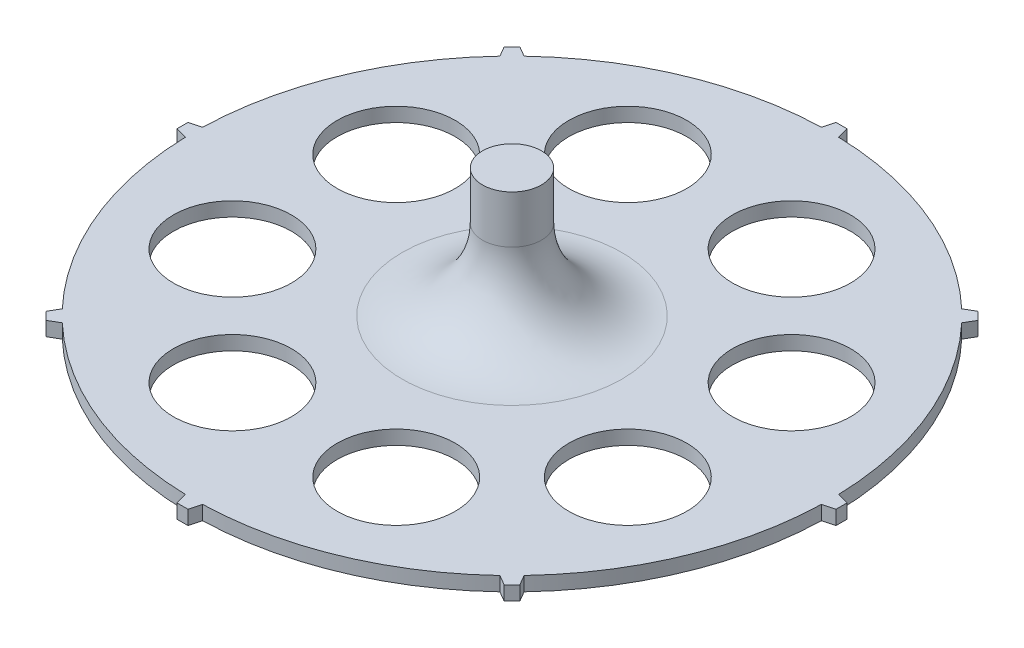
from build123d import *

# Parameters (mm, degrees)
SKETCH1_R            = 85.725
BOSS_EXTRUDE1_DEPTH  = 62.865
FILLET1_R            = 3.175
FILLET1_OF_MIRROR1_R = 3.175
FILLET2_R            = 21.59
CUT_EXTRUDE2_START   = 34.45
SKETCH5_R            = 92.075
SKETCH5_R_2          = 85.725
CUT_EXTRUDE2_DEPTH   = 219.00798967
SKETCH6_W            = 171.45
SKETCH6_H            = 25.581957496
CUT_EXTRUDE3_DEPTH   = 88.9
BOSS_EXTRUDE2_START  = -94.93
BOSS_EXTRUDE2_DEPTH  = 3.81
CUT_EXTRUDE5_DEPTH   = 130.946195435
SKETCH9_R            = 15.875
CUT_EXTRUDE6_DEPTH   = 130.946195435


with BuildPart() as part:
    # Sketch1 → Boss-Extrude1 (new, symmetric)
    with BuildSketch(Plane(origin=(0, 0, 0), x_dir=(1, 0, 0), z_dir=(0, 1, 0))):
        with BuildLine():
            Line((13.371386035, 89.497618576), (13.619190523, 91.06219454))
            ThreePointArc((13.619190523, 91.06219454), (7.224121239, 91.791163503), (0.79375, 92.0715786))
            Line((0.79375, 92.0715786), (0.79375, 90.4875))
            Line((0.79375, 90.4875), (-0.79375, 90.4875))
            Line((-0.79375, 90.4875), (-0.79375, 92.0715786))
            ThreePointArc((-0.79375, 92.0715786), (-7.224121239, 91.791163503), (-13.619190523, 91.06219454))
            Line((-13.619190523, 91.06219454), (-13.371386035, 89.497618576))
            Line((-13.371386035, 89.497618576), (-14.939341276, 89.249278863))
            Line((-14.939341276, 89.249278863), (-15.187145764, 90.813854827))
            ThreePointArc((-15.187145764, 90.813854827), (-21.494481877, 89.530960421), (-27.696781377, 87.810557033))
            Line((-27.696781377, 87.810557033), (-27.207274169, 86.304008758))
            Line((-27.207274169, 86.304008758), (-28.717076388, 85.813444279))
            Line((-28.717076388, 85.813444279), (-29.206583596, 87.319992554))
            ThreePointArc((-29.206583596, 87.319992554), (-35.235577035, 85.066207956), (-41.092385552, 82.396732184))
            Line((-41.092385552, 82.396732184), (-40.373228917, 80.985307817))
            Line((-40.373228917, 80.985307817), (-41.787701774, 80.264597898))
            Line((-41.787701774, 80.264597898), (-42.506858409, 81.676022266))
            ThreePointArc((-42.506858409, 81.676022266), (-48.109055346, 78.506843133), (-53.476158817, 74.954026331))
            Line((-53.476158817, 74.954026331), (-52.545060778, 73.672479823))
            Line((-52.545060778, 73.672479823), (-53.829375256, 72.739370734))
            Line((-53.829375256, 72.739370734), (-54.760473296, 74.020917243))
            ThreePointArc((-54.760473296, 74.020917243), (-59.79792905, 70.014379283), (-64.543171575, 65.66570359))
            Line((-64.543171575, 65.66570359), (-63.423058855, 64.54559087))
            Line((-63.423058855, 64.54559087), (-64.54559087, 63.423058855))
            Line((-64.54559087, 63.423058855), (-65.66570359, 64.543171575))
            ThreePointArc((-65.66570359, 64.543171575), (-70.014379283, 59.79792905), (-74.020917243, 54.760473296))
            Line((-74.020917243, 54.760473296), (-72.739370734, 53.829375256))
            Line((-72.739370734, 53.829375256), (-73.672479823, 52.545060778))
            Line((-73.672479823, 52.545060778), (-74.954026331, 53.476158817))
            ThreePointArc((-74.954026331, 53.476158817), (-78.506843133, 48.109055346), (-81.676022266, 42.506858409))
            Line((-81.676022266, 42.506858409), (-80.264597898, 41.787701774))
            Line((-80.264597898, 41.787701774), (-80.985307817, 40.373228917))
            Line((-80.985307817, 40.373228917), (-82.396732184, 41.092385552))
            ThreePointArc((-82.396732184, 41.092385552), (-85.066207956, 35.235577035), (-87.319992554, 29.206583596))
            Line((-87.319992554, 29.206583596), (-85.813444279, 28.717076388))
            Line((-85.813444279, 28.717076388), (-86.304008758, 27.207274169))
            Line((-86.304008758, 27.207274169), (-87.810557033, 27.696781377))
            ThreePointArc((-87.810557033, 27.696781377), (-89.530960421, 21.494481877), (-90.813854827, 15.187145764))
            Line((-90.813854827, 15.187145764), (-89.249278863, 14.939341276))
            Line((-89.249278863, 14.939341276), (-89.497618576, 13.371386035))
            Line((-89.497618576, 13.371386035), (-91.06219454, 13.619190523))
            ThreePointArc((-91.06219454, 13.619190523), (-91.791163503, 7.224121239), (-92.0715786, 0.79375))
            Line((-92.0715786, 0.79375), (-90.4875, 0.79375))
            Line((-90.4875, 0.79375), (-90.4875, -0.79375))
            Line((-90.4875, -0.79375), (-92.0715786, -0.79375))
            ThreePointArc((-92.0715786, -0.79375), (-91.791163503, -7.224121239), (-91.06219454, -13.619190523))
            Line((-91.06219454, -13.619190523), (-89.497618576, -13.371386035))
            Line((-89.497618576, -13.371386035), (-89.249278863, -14.939341276))
            Line((-89.249278863, -14.939341276), (-90.813854827, -15.187145764))
            ThreePointArc((-90.813854827, -15.187145764), (-89.530960421, -21.494481877), (-87.810557033, -27.696781377))
            Line((-87.810557033, -27.696781377), (-86.304008758, -27.207274169))
            Line((-86.304008758, -27.207274169), (-85.813444279, -28.717076388))
            Line((-85.813444279, -28.717076388), (-87.319992554, -29.206583596))
            ThreePointArc((-87.319992554, -29.206583596), (-85.066207956, -35.235577035), (-82.396732184, -41.092385552))
            Line((-82.396732184, -41.092385552), (-80.985307817, -40.373228917))
            Line((-80.985307817, -40.373228917), (-80.264597898, -41.787701774))
            Line((-80.264597898, -41.787701774), (-81.676022266, -42.506858409))
            ThreePointArc((-81.676022266, -42.506858409), (-78.506843133, -48.109055346), (-74.954026331, -53.476158817))
            Line((-74.954026331, -53.476158817), (-73.672479822, -52.545060778))
            Line((-73.672479822, -52.545060778), (-72.739370734, -53.829375256))
            Line((-72.739370734, -53.829375256), (-74.020917242, -54.760473296))
            ThreePointArc((-74.020917242, -54.760473296), (-70.014379283, -59.79792905), (-65.66570359, -64.543171575))
            Line((-65.66570359, -64.543171575), (-64.54559087, -63.423058855))
            Line((-64.54559087, -63.423058855), (-63.423058855, -64.54559087))
            Line((-63.423058855, -64.54559087), (-64.543171575, -65.66570359))
            ThreePointArc((-64.543171575, -65.66570359), (-59.79792905, -70.014379283), (-54.760473296, -74.020917243))
            Line((-54.760473296, -74.020917243), (-53.829375256, -72.739370735))
            Line((-53.829375256, -72.739370735), (-52.545060778, -73.672479823))
            Line((-52.545060778, -73.672479823), (-53.476158817, -74.954026331))
            ThreePointArc((-53.476158817, -74.954026331), (-48.109055346, -78.506843133), (-42.506858409, -81.676022266))
            Line((-42.506858409, -81.676022266), (-41.787701774, -80.264597898))
            Line((-41.787701774, -80.264597898), (-40.373228917, -80.985307817))
            Line((-40.373228917, -80.985307817), (-41.092385552, -82.396732184))
            ThreePointArc((-41.092385552, -82.396732184), (-35.235577035, -85.066207956), (-29.206583596, -87.319992554))
            Line((-29.206583596, -87.319992554), (-28.717076388, -85.813444279))
            Line((-28.717076388, -85.813444279), (-27.207274169, -86.304008758))
            Line((-27.207274169, -86.304008758), (-27.696781377, -87.810557033))
            ThreePointArc((-27.696781377, -87.810557033), (-21.494481877, -89.530960421), (-15.187145764, -90.813854827))
            Line((-15.187145764, -90.813854827), (-14.939341276, -89.249278863))
            Line((-14.939341276, -89.249278863), (-13.371386035, -89.497618576))
            Line((-13.371386035, -89.497618576), (-13.619190523, -91.06219454))
            ThreePointArc((-13.619190523, -91.06219454), (-7.224121239, -91.791163503), (-0.79375, -92.0715786))
            Line((-0.79375, -92.0715786), (-0.79375, -90.4875))
            Line((-0.79375, -90.4875), (0.79375, -90.4875))
            Line((0.79375, -90.4875), (0.79375, -92.0715786))
            ThreePointArc((0.79375, -92.0715786), (7.224121239, -91.791163503), (13.619190523, -91.06219454))
            Line((13.619190523, -91.06219454), (13.371386035, -89.497618576))
            Line((13.371386035, -89.497618576), (14.939341276, -89.249278863))
            Line((14.939341276, -89.249278863), (15.187145764, -90.813854827))
            ThreePointArc((15.187145764, -90.813854827), (21.494481877, -89.530960421), (27.696781377, -87.810557033))
            Line((27.696781377, -87.810557033), (27.207274169, -86.304008758))
            Line((27.207274169, -86.304008758), (28.717076388, -85.813444279))
            Line((28.717076388, -85.813444279), (29.206583596, -87.319992554))
            ThreePointArc((29.206583596, -87.319992554), (35.235577035, -85.066207956), (41.092385552, -82.396732184))
            Line((41.092385552, -82.396732184), (40.373228917, -80.985307817))
            Line((40.373228917, -80.985307817), (41.787701774, -80.264597898))
            Line((41.787701774, -80.264597898), (42.506858409, -81.676022266))
            ThreePointArc((42.506858409, -81.676022266), (48.109055346, -78.506843133), (53.476158817, -74.954026331))
            Line((53.476158817, -74.954026331), (52.545060778, -73.672479823))
            Line((52.545060778, -73.672479823), (53.829375256, -72.739370734))
            Line((53.829375256, -72.739370734), (54.760473296, -74.020917242))
            ThreePointArc((54.760473296, -74.020917242), (59.79792905, -70.014379283), (64.543171575, -65.66570359))
            Line((64.543171575, -65.66570359), (63.423058855, -64.54559087))
            Line((63.423058855, -64.54559087), (64.54559087, -63.423058855))
            Line((64.54559087, -63.423058855), (65.66570359, -64.543171575))
            ThreePointArc((65.66570359, -64.543171575), (70.014379283, -59.79792905), (74.020917243, -54.760473296))
            Line((74.020917243, -54.760473296), (72.739370735, -53.829375256))
            Line((72.739370735, -53.829375256), (73.672479823, -52.545060778))
            Line((73.672479823, -52.545060778), (74.954026331, -53.476158817))
            ThreePointArc((74.954026331, -53.476158817), (78.506843133, -48.109055346), (81.676022266, -42.506858409))
            Line((81.676022266, -42.506858409), (80.264597898, -41.787701774))
            Line((80.264597898, -41.787701774), (80.985307817, -40.373228917))
            Line((80.985307817, -40.373228917), (82.396732184, -41.092385552))
            ThreePointArc((82.396732184, -41.092385552), (85.066207956, -35.235577035), (87.319992554, -29.206583596))
            Line((87.319992554, -29.206583596), (85.813444279, -28.717076388))
            Line((85.813444279, -28.717076388), (86.304008758, -27.207274169))
            Line((86.304008758, -27.207274169), (87.810557033, -27.696781377))
            ThreePointArc((87.810557033, -27.696781377), (89.530960421, -21.494481877), (90.813854827, -15.187145764))
            Line((90.813854827, -15.187145764), (89.249278863, -14.939341276))
            Line((89.249278863, -14.939341276), (89.497618576, -13.371386035))
            Line((89.497618576, -13.371386035), (91.06219454, -13.619190523))
            ThreePointArc((91.06219454, -13.619190523), (91.791163503, -7.224121239), (92.0715786, -0.79375))
            Line((92.0715786, -0.79375), (90.4875, -0.79375))
            Line((90.4875, -0.79375), (90.4875, 0.79375))
            Line((90.4875, 0.79375), (92.0715786, 0.79375))
            ThreePointArc((92.0715786, 0.79375), (91.791163503, 7.224121239), (91.06219454, 13.619190523))
            Line((91.06219454, 13.619190523), (89.497618576, 13.371386035))
            Line((89.497618576, 13.371386035), (89.249278863, 14.939341276))
            Line((89.249278863, 14.939341276), (90.813854827, 15.187145764))
            ThreePointArc((90.813854827, 15.187145764), (89.530960421, 21.494481877), (87.810557033, 27.696781377))
            Line((87.810557033, 27.696781377), (86.304008758, 27.207274169))
            Line((86.304008758, 27.207274169), (85.813444279, 28.717076388))
            Line((85.813444279, 28.717076388), (87.319992554, 29.206583596))
            ThreePointArc((87.319992554, 29.206583596), (85.066207956, 35.235577035), (82.396732184, 41.092385552))
            Line((82.396732184, 41.092385552), (80.985307817, 40.373228917))
            Line((80.985307817, 40.373228917), (80.264597898, 41.787701774))
            Line((80.264597898, 41.787701774), (81.676022266, 42.506858409))
            ThreePointArc((81.676022266, 42.506858409), (78.506843133, 48.109055346), (74.954026331, 53.476158817))
            Line((74.954026331, 53.476158817), (73.672479823, 52.545060778))
            Line((73.672479823, 52.545060778), (72.739370735, 53.829375256))
            Line((72.739370735, 53.829375256), (74.020917243, 54.760473296))
            ThreePointArc((74.020917243, 54.760473296), (70.014379283, 59.79792905), (65.66570359, 64.543171575))
            Line((65.66570359, 64.543171575), (64.54559087, 63.423058855))
            Line((64.54559087, 63.423058855), (63.423058855, 64.54559087))
            Line((63.423058855, 64.54559087), (64.543171575, 65.66570359))
            ThreePointArc((64.543171575, 65.66570359), (59.79792905, 70.014379283), (54.760473296, 74.020917243))
            Line((54.760473296, 74.020917243), (53.829375256, 72.739370735))
            Line((53.829375256, 72.739370735), (52.545060778, 73.672479823))
            Line((52.545060778, 73.672479823), (53.476158817, 74.954026331))
            ThreePointArc((53.476158817, 74.954026331), (48.109055346, 78.506843133), (42.506858409, 81.676022266))
            Line((42.506858409, 81.676022266), (41.787701774, 80.264597898))
            Line((41.787701774, 80.264597898), (40.373228917, 80.985307817))
            Line((40.373228917, 80.985307817), (41.092385552, 82.396732184))
            ThreePointArc((41.092385552, 82.396732184), (35.235577035, 85.066207956), (29.206583596, 87.319992554))
            Line((29.206583596, 87.319992554), (28.717076388, 85.813444279))
            Line((28.717076388, 85.813444279), (27.207274169, 86.304008758))
            Line((27.207274169, 86.304008758), (27.696781377, 87.810557033))
            ThreePointArc((27.696781377, 87.810557033), (21.494481877, 89.530960421), (15.187145764, 90.813854827))
            Line((15.187145764, 90.813854827), (14.939341276, 89.249278863))
            Line((14.939341276, 89.249278863), (13.371386035, 89.497618576))
        make_face()
        with Locations(Location((0, 0, 0), (0, 0, 270))):
            Circle(SKETCH1_R, mode=Mode.SUBTRACT)
    extrude(amount=BOSS_EXTRUDE1_DEPTH, both=True)

    # Sketch2 → Revolve1 (revolve)
    with BuildSketch(Plane.XY):
        Polygon((0, 81.915), (0, 41.115), (-85.725, 41.115), (-85.725, 47.465), (-7.9375, 47.465), (-7.9375, 81.915), align=None)
    revolve1 = revolve(axis=Axis((0, 81.915, 0), (0, -1, 0)))

    # Fillet1
    fillet1_edges = [part.edges().sort_by_distance(p)[0] for p in [
        (0, 41.115, -85.725),
    ]]
    fillet(fillet1_edges, radius=FILLET1_R)

    # Mirror1: Revolve1 across plane
    add(revolve1.mirror(Plane.ZX))

    # Fillet1 of Mirror1
    fillet1_of_mirror1_edges = [part.edges().sort_by_distance(p)[0] for p in [
        (0, -41.115, -85.725),
    ]]
    fillet(fillet1_of_mirror1_edges, radius=FILLET1_OF_MIRROR1_R)

    # Fillet2
    fillet2_edges = [part.edges().sort_by_distance(p)[0] for p in [
        (7.9375, 47.465, 0),
        (7.9375, -47.465, 0),
    ]]
    fillet(fillet2_edges, radius=FILLET2_R)

    # Sketch5 → Cut-Extrude2 (cut, through all)
    with BuildSketch(Plane.XZ.offset(47.465).offset(CUT_EXTRUDE2_START)):
        Circle(SKETCH5_R)
        Circle(SKETCH5_R_2, mode=Mode.SUBTRACT)
    extrude(amount=-CUT_EXTRUDE2_DEPTH, mode=Mode.SUBTRACT)


with BuildPart() as cut_extrude2_kept_piece:
    # of the separate pieces the step leaves, the one the design keeps (cut_extrude2_pieces_kept)
    add(part.part.solids().sort_by_distance((-29.5275, 47.465, 0))[0])

    # Sketch6 → Cut-Extrude3 (cut, symmetric)
    with BuildSketch(Plane.XY):
        with Locations((0, 30.864021252)):
            Rectangle(SKETCH6_W, SKETCH6_H)
    extrude(amount=CUT_EXTRUDE3_DEPTH, both=True, mode=Mode.SUBTRACT)

    # Sketch5<5> → Boss-Extrude2 (add)
    with BuildSketch(Plane.XZ.offset(47.465).offset(BOSS_EXTRUDE2_START)):
        with BuildLine():
            Line((1.489458784, -88.598), (2.249038414, -85.695492596))
            ThreePointArc((2.249038414, -85.695492596), (0, -85.725), (-2.249038414, -85.695492596))
            Line((-2.249038414, -85.695492596), (-1.489458784, -88.598))
            Line((-1.489458784, -88.598), (1.489458784, -88.598))
        make_face()
        with BuildLine():
            Line((-61.595040193, -63.701453006), (-59.005553618, -62.186174245))
            ThreePointArc((-59.005553618, -62.186174245), (-60.616728817, -60.616728817), (-62.186174245, -59.005553618))
            Line((-62.186174245, -59.005553618), (-63.701453006, -61.595040193))
            Line((-63.701453006, -61.595040193), (-61.595040193, -63.701453006))
        make_face()
        with BuildLine():
            ThreePointArc((-85.695492596, -2.249038414), (-85.725, 0), (-85.695492596, 2.249038414))
            Line((-85.695492596, 2.249038414), (-88.598, 1.489458784))
            Line((-88.598, 1.489458784), (-88.598, -1.489458784))
            Line((-88.598, -1.489458784), (-85.695492596, -2.249038414))
        make_face()
        with BuildLine():
            ThreePointArc((-62.186174245, 59.005553618), (-60.616728817, 60.616728817), (-59.005553618, 62.186174245))
            Line((-59.005553618, 62.186174245), (-61.595040193, 63.701453006))
            Line((-61.595040193, 63.701453006), (-63.701453006, 61.595040193))
            Line((-63.701453006, 61.595040193), (-62.186174245, 59.005553618))
        make_face()
        with BuildLine():
            ThreePointArc((-2.249038414, 85.695492596), (0, 85.725), (2.249038414, 85.695492596))
            Line((2.249038414, 85.695492596), (1.489458784, 88.598))
            Line((1.489458784, 88.598), (-1.489458784, 88.598))
            Line((-1.489458784, 88.598), (-2.249038414, 85.695492596))
        make_face()
        with BuildLine():
            ThreePointArc((59.005553618, 62.186174245), (60.616728817, 60.616728817), (62.186174245, 59.005553618))
            Line((62.186174245, 59.005553618), (63.701453006, 61.595040193))
            Line((63.701453006, 61.595040193), (61.595040193, 63.701453006))
            Line((61.595040193, 63.701453006), (59.005553618, 62.186174245))
        make_face()
        with BuildLine():
            Line((88.598, 1.489458784), (85.695492596, 2.249038414))
            ThreePointArc((85.695492596, 2.249038414), (85.717622831, 1.124615987), (85.725, 0))
            ThreePointArc((85.725, 0), (85.717622831, -1.124615987), (85.695492596, -2.249038414))
            Line((85.695492596, -2.249038414), (88.598, -1.489458784))
            Line((88.598, -1.489458784), (88.598, 1.489458784))
        make_face()
        with BuildLine():
            Line((63.701453006, -61.595040193), (62.186174245, -59.005553618))
            ThreePointArc((62.186174245, -59.005553618), (60.616728817, -60.616728817), (59.005553618, -62.186174245))
            Line((59.005553618, -62.186174245), (61.595040193, -63.701453006))
            Line((61.595040193, -63.701453006), (63.701453006, -61.595040193))
        make_face()
    extrude(amount=BOSS_EXTRUDE2_DEPTH)

    # Sketch8 → Cut-Extrude5 (cut, through all)
    with BuildSketch(Plane(origin=(0, 47.465, 0), x_dir=(1, 0, 0), z_dir=(0, 1, 0))):
        with BuildLine():
            Line((-85.503591154, -2.299258587), (-85.695492596, -2.249038414))
            ThreePointArc((-85.695492596, -2.249038414), (-79.199572925, -32.805537239), (-62.186174245, -59.005553618))
            Line((-62.186174245, -59.005553618), (-62.08599046, -58.834347782))
            ThreePointArc((-62.08599046, -58.834347782), (-79.023573874, -32.732636046), (-85.503591154, -2.299258587))
        make_face()
        with BuildLine():
            ThreePointArc((-2.299258587, -85.503591154), (-32.732636046, -79.023573874), (-58.834347782, -62.08599046))
            Line((-58.834347782, -62.08599046), (-59.005553618, -62.186174245))
            ThreePointArc((-59.005553618, -62.186174245), (-32.805537239, -79.199572925), (-2.249038414, -85.695492596))
            Line((-2.249038414, -85.695492596), (-2.299258587, -85.503591154))
        make_face()
        with BuildLine():
            ThreePointArc((58.834347782, -62.08599046), (32.732636046, -79.023573874), (2.299258587, -85.503591154))
            Line((2.299258587, -85.503591154), (2.249038414, -85.695492596))
            ThreePointArc((2.249038414, -85.695492596), (32.805537239, -79.199572925), (59.005553618, -62.186174245))
            Line((59.005553618, -62.186174245), (58.834347782, -62.08599046))
        make_face()
        with BuildLine():
            ThreePointArc((85.503591154, -2.299258587), (79.023573874, -32.732636046), (62.08599046, -58.834347782))
            Line((62.08599046, -58.834347782), (62.186174245, -59.005553618))
            ThreePointArc((62.186174245, -59.005553618), (79.199572925, -32.805537239), (85.695492596, -2.249038414))
            Line((85.695492596, -2.249038414), (85.503591154, -2.299258587))
        make_face()
        with BuildLine():
            Line((62.186174245, 59.005553618), (62.08599046, 58.834347782))
            ThreePointArc((62.08599046, 58.834347782), (79.023573874, 32.732636046), (85.503591154, 2.299258587))
            Line((85.503591154, 2.299258587), (85.695492596, 2.249038414))
            ThreePointArc((85.695492596, 2.249038414), (79.199572925, 32.805537239), (62.186174245, 59.005553618))
        make_face()
        with BuildLine():
            Line((2.249038414, 85.695492596), (2.299258587, 85.503591154))
            ThreePointArc((2.299258587, 85.503591154), (32.732636046, 79.023573874), (58.834347782, 62.08599046))
            Line((58.834347782, 62.08599046), (59.005553618, 62.186174245))
            ThreePointArc((59.005553618, 62.186174245), (32.805537239, 79.199572925), (2.249038414, 85.695492596))
        make_face()
        with BuildLine():
            Line((-59.005553618, 62.186174245), (-58.834347782, 62.08599046))
            ThreePointArc((-58.834347782, 62.08599046), (-32.732636046, 79.023573874), (-2.299258587, 85.503591154))
            Line((-2.299258587, 85.503591154), (-2.249038414, 85.695492596))
            ThreePointArc((-2.249038414, 85.695492596), (-32.805537239, 79.199572925), (-59.005553618, 62.186174245))
        make_face()
        with BuildLine():
            Line((-85.695492596, 2.249038414), (-85.503591154, 2.299258587))
            ThreePointArc((-85.503591154, 2.299258587), (-79.023573874, 32.732636046), (-62.08599046, 58.834347782))
            Line((-62.08599046, 58.834347782), (-62.186174245, 59.005553618))
            ThreePointArc((-62.186174245, 59.005553618), (-79.199572925, 32.805537239), (-85.695492596, 2.249038414))
        make_face()
    extrude(amount=-CUT_EXTRUDE5_DEPTH, mode=Mode.SUBTRACT)

    # Sketch9 → Cut-Extrude6 (cut, through all)
    with BuildSketch(Plane(origin=(0, 47.465, 0), x_dir=(1, 0, 0), z_dir=(0, 1, 0))):
        with Locations(Location((-22.016160547, 53.151713385, 0), (0, 0, 180))):
            Circle(SKETCH9_R)
        with Locations(Location((22.016160547, 53.151713385, 0), (0, 0, 180))):
            Circle(SKETCH9_R)
        with Locations(Location((53.151713385, 22.016160547, 0), (0, 0, 180))):
            Circle(SKETCH9_R)
        with Locations(Location((53.151713385, -22.016160547, 0), (0, 0, 180))):
            Circle(SKETCH9_R)
        with Locations(Location((22.016160547, -53.151713385, 0), (0, 0, 180))):
            Circle(SKETCH9_R)
        with Locations(Location((-22.016160547, -53.151713385, 0), (0, 0, 180))):
            Circle(SKETCH9_R)
        with Locations(Location((-53.151713385, -22.016160547, 0), (0, 0, 180))):
            Circle(SKETCH9_R)
        with Locations(Location((-53.151713385, 22.016160547, 0), (0, 0, 180))):
            Circle(SKETCH9_R)
    extrude(amount=-CUT_EXTRUDE6_DEPTH, mode=Mode.SUBTRACT)


solid = cut_extrude2_kept_piece.part
